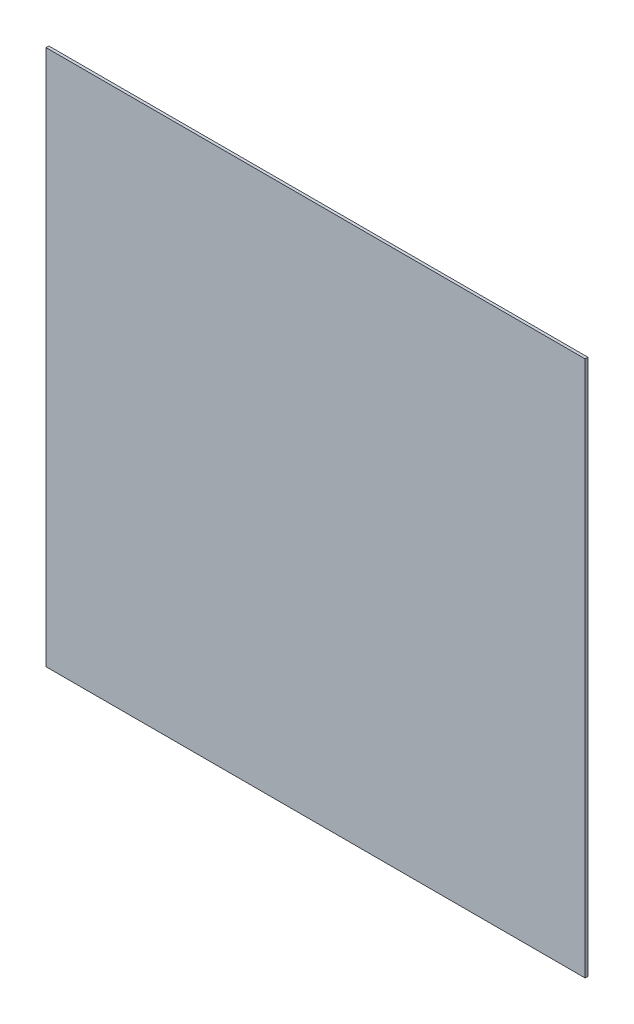
from build123d import *

# Parameters (mm, degrees)
SKETCH1_W           = 609.6
SKETCH1_H           = 606.425
BOSS_EXTRUDE1_DEPTH = 3.175


with BuildPart() as part:
    # Sketch1 → Boss-Extrude1 (new body)
    with BuildSketch(Plane.XY):
        Rectangle(SKETCH1_W, SKETCH1_H)
    extrude(amount=BOSS_EXTRUDE1_DEPTH)


solid = part.part
